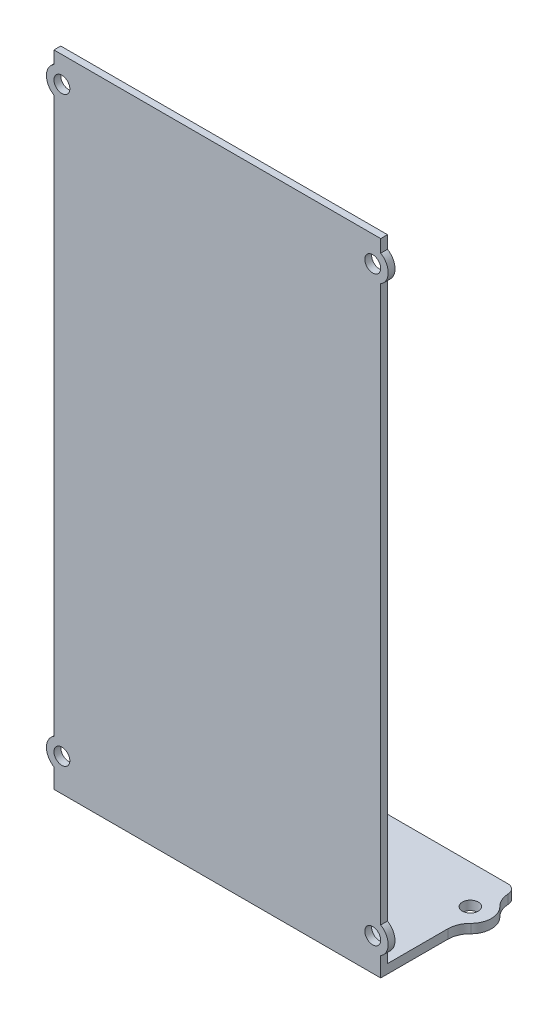
from build123d import *

# Parameters (mm, degrees)
SKETCH1_R               = 1.75
BOSS_EXTRUDE1_DEPTH     = 1.5
BOSS_EXTRUDE2_START     = -72
BOSS_EXTRUDE2_DEPTH     = 72
BOSS_EXTRUDE4_DEPTH     = 2
SKETCH5_R               = 1.75
CUT_EXTRUDE1_DEPTH      = 2
CUT_EXTRUDE2_DEPTH      = 152.713437324
CUT_EXTRUDE2_DEPTH_BACK = 152.713437324
SKETCH6_W               = 72
SKETCH6_H               = 11.5
FILLET1_R               = 2
SKETCH8_W               = 36
SKETCH8_H               = 18
CUT_EXTRUDE3_DEPTH      = 22.4262221
SKETCH11_W              = 3
SKETCH11_H              = 15
BOSS_EXTRUDE7_DEPTH     = 15
CUT_EXTRUDE5_REACH      = 154.64
FILLET3_R               = 5


with BuildPart() as part:
    # Sketch1 → Boss-Extrude1 (new body)
    with BuildSketch(Plane.XY):
        with BuildLine():
            Line((-32.5, -138.9), (32.5, -138.9))
            Line((32.5, -138.9), (36, -138.9))
            Line((36, -138.9), (36, -136.815047169))
            ThreePointArc((36, -136.815047169), (37.65, -133.9), (36, -130.984952831))
            Line((36, -130.984952831), (36, -8.615047169))
            ThreePointArc((36, -8.615047169), (37.65, -5.7), (36, -2.784952831))
            Line((36, -2.784952831), (36, 0))
            Line((36, 0), (-36, 0))
            Line((-36, 0), (-36, -2.784952831))
            ThreePointArc((-36, -2.784952831), (-37.65, -5.7), (-36, -8.615047169))
            Line((-36, -8.615047169), (-36, -130.984952831))
            ThreePointArc((-36, -130.984952831), (-37.65, -133.9), (-36, -136.815047169))
            Line((-36, -136.815047169), (-36, -138.9))
            Line((-36, -138.9), (-32.5, -138.9))
        make_face()
        with Locations((-34.25, -133.9)):
            Circle(SKETCH1_R, mode=Mode.SUBTRACT)
        with Locations((34.25, -133.9)):
            Circle(SKETCH1_R, mode=Mode.SUBTRACT)
        with Locations((34.25, -5.7)):
            Circle(SKETCH1_R, mode=Mode.SUBTRACT)
        with Locations((-34.25, -5.7)):
            Circle(SKETCH1_R, mode=Mode.SUBTRACT)
    extrude(amount=BOSS_EXTRUDE1_DEPTH)

    # Sketch2 → Boss-Extrude2 (add)
    with BuildSketch(Plane.ZY.offset(36).offset(BOSS_EXTRUDE2_START)):
        Polygon((1.5, -141.1), (1.5, -138.9), (0, -138.9), (0, -139.1), (-40, -139.1), (-40, -141.1), align=None)
    extrude(amount=BOSS_EXTRUDE2_DEPTH)

    # Sketch4 → Boss-Extrude4 (add)
    with BuildSketch(Plane.XZ.offset(141.1)):
        with BuildLine():
            Line((-36, -15.904411924), (-36, -24.211404996))
            ThreePointArc((-36, -24.211404996), (-38.768391924, -20.05790846), (-36, -15.904411924))
        make_face()
        with BuildLine():
            Line((36, -15.879321263), (36, -24.236495657))
            ThreePointArc((36, -24.236495657), (38.8298476, -20.05790846), (36, -15.879321263))
        make_face()
    extrude(amount=-BOSS_EXTRUDE4_DEPTH)

    # Sketch5 → Cut-Extrude1 (cut)
    with BuildSketch(Plane.XZ.offset(141.1)):
        with Locations(Location((-34.25, -20, 0), (0, 0, 270))):
            Circle(SKETCH5_R)
        with Locations(Location((34.25, -20, 0), (0, 0, 270))):
            Circle(SKETCH5_R)
    extrude(amount=-CUT_EXTRUDE1_DEPTH, mode=Mode.SUBTRACT)

    # Sketch6 → Cut-Extrude2 (cut, two sides: drawn at the far end of the back side and taken through both)
    with BuildSketch(Plane.XZ.offset(141.1).offset(-CUT_EXTRUDE2_DEPTH_BACK)):
        with Locations((0, -34.25)):
            Rectangle(SKETCH6_W, SKETCH6_H)
    extrude(amount=CUT_EXTRUDE2_DEPTH + CUT_EXTRUDE2_DEPTH_BACK, mode=Mode.SUBTRACT)

    # Fillet1
    fillet1_edges = [part.edges().sort_by_distance(p)[0] for p in [
        (36, -140.1, -28.5),
        (-36, -140.1, -28.5),
    ]]
    fillet(fillet1_edges, radius=FILLET1_R)

    # Sketch8 → Cut-Extrude3 (cut)
    with BuildSketch(Plane.XZ.offset(141.1)):
        with Locations((-9, -14.5)):
            Rectangle(SKETCH8_W, SKETCH8_H)
    extrude(amount=-CUT_EXTRUDE3_DEPTH, mode=Mode.SUBTRACT)

    # Sketch11 → Boss-Extrude7 (add)
    with BuildSketch(Plane(origin=(0, -139.1, 0), x_dir=(1, 0, 0), z_dir=(0, 1, 0))):
        with Locations((10.5, 7.5)):
            Rectangle(SKETCH11_W, SKETCH11_H)
    extrude(amount=BOSS_EXTRUDE7_DEPTH)

    # Sketch12 → Cut-Extrude5 (cut, up to next)
    with BuildSketch(Plane(origin=(12, 0, 0), x_dir=(0, 0, -1), z_dir=(1, 0, 0)), mode=Mode.PRIVATE) as cut_extrude5_sk1:
        Polygon((0, -124.1), (15, -139.1), (15, -124.1), align=None)
    cut_extrude5_tool1 = extrude(cut_extrude5_sk1.sketch, amount=-CUT_EXTRUDE5_REACH, mode=Mode.PRIVATE) & part.part
    add(cut_extrude5_tool1.solids().sort_by_distance((12, -129.1, -10))[0], mode=Mode.SUBTRACT)

    # Fillet3
    fillet3_edges = [part.edges().sort_by_distance(p)[0] for p in [
        (36, -140.1, -24.236495657),
        (36, -140.1, -15.879321263),
        (-36, -140.1, -15.904411924),
        (-36, -140.1, -24.211404996),
    ]]
    fillet(fillet3_edges, radius=FILLET3_R)


solid = part.part
